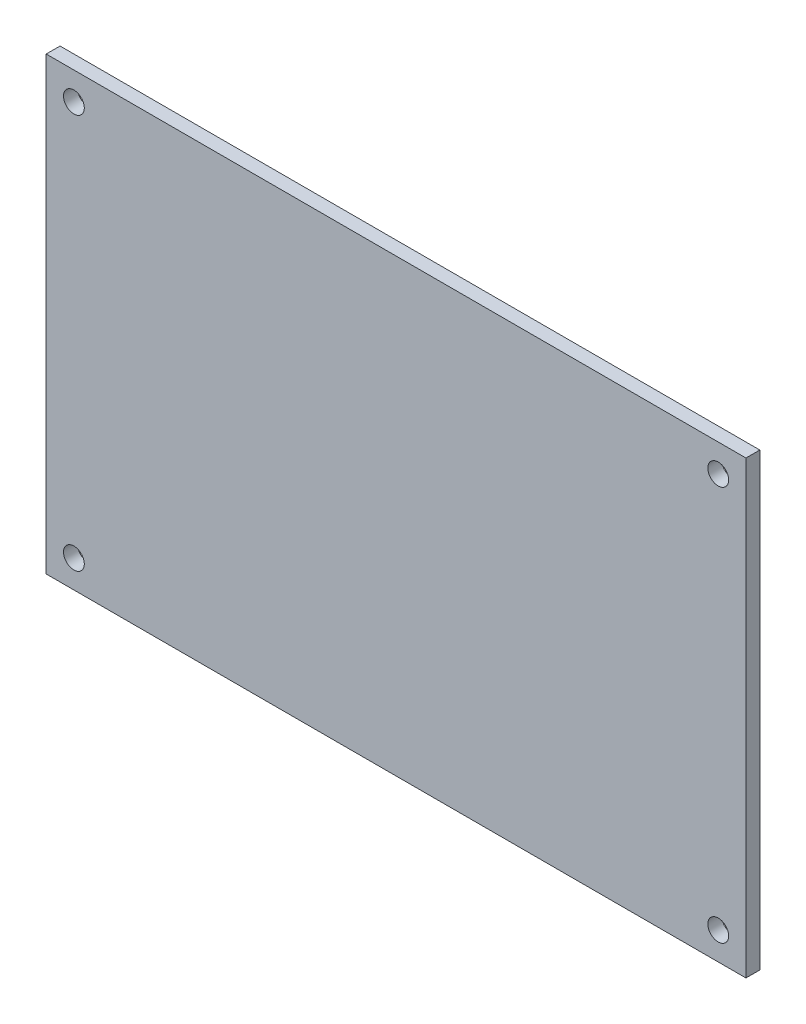
from build123d import *

# Parameters (mm, degrees)
IZIM1_W                     = 101
IZIM1_H                     = 65
Y_KSEKLIK_EKSTR_ZYON1_DEPTH = 2
SKETCH1_R                   = 1.5
CUT_EXTRUDE1_DEPTH          = 121.124934964


with BuildPart() as part:
    # Çizim1 → Yükseklik-Ekstrüzyon1 (new body)
    with BuildSketch(Plane.XY):
        with Locations((50.5, 32.5)):
            Rectangle(IZIM1_W, IZIM1_H)
    extrude(amount=Y_KSEKLIK_EKSTR_ZYON1_DEPTH)

    # Sketch1 → Cut-Extrude1 (cut, through all)
    with BuildSketch(Plane.XY.offset(2)):
        with Locations((4, 61)):
            Circle(SKETCH1_R)
        with Locations((97, 61)):
            Circle(SKETCH1_R)
        with Locations((97, 4)):
            Circle(SKETCH1_R)
        with Locations((4, 4)):
            Circle(SKETCH1_R)
    extrude(amount=-CUT_EXTRUDE1_DEPTH, mode=Mode.SUBTRACT)


solid = part.part
